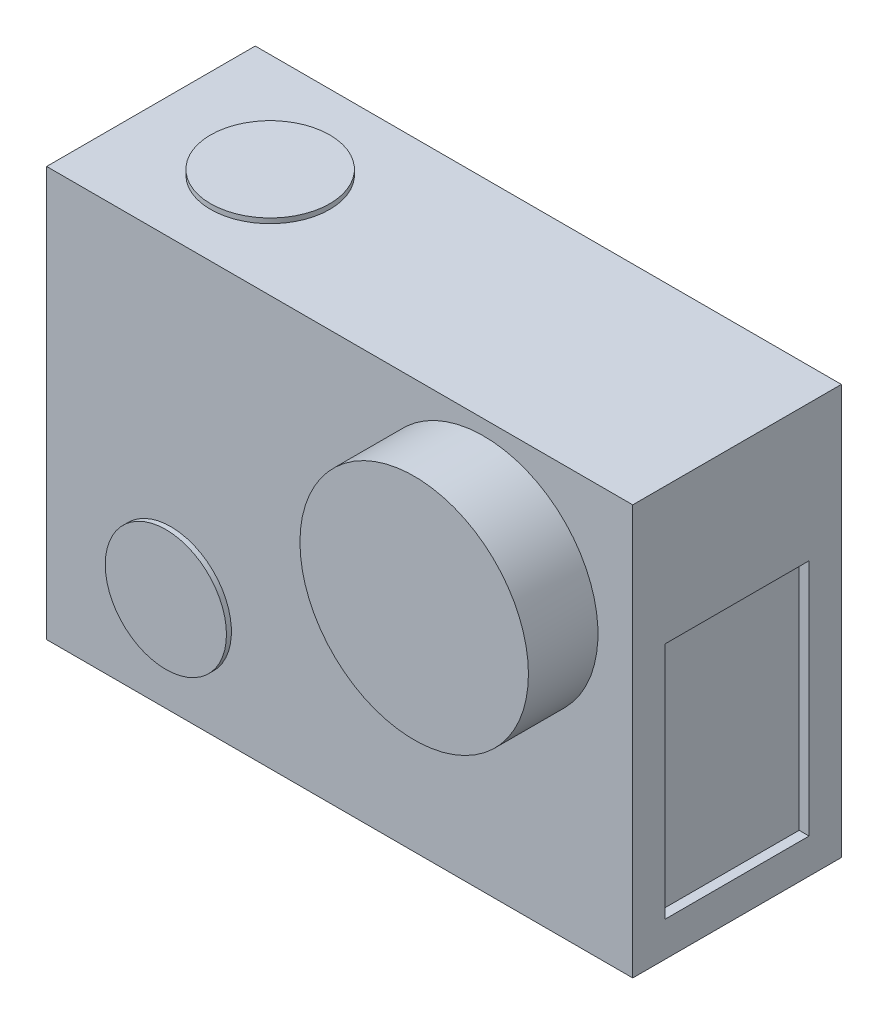
from build123d import *

# Parameters (mm, degrees)
SKETCH1_W           = 59
SKETCH1_H           = 41.25
BOSS_EXTRUDE1_DEPTH = 21
SKETCH2_R           = 11.5
BOSS_EXTRUDE2_DEPTH = 7
SKETCH3_R           = 6.1
BOSS_EXTRUDE3_DEPTH = 0.5
SKETCH4_W           = 14.5
SKETCH4_H           = 24
CUT_EXTRUDE1_DEPTH  = 1
SKETCH5_W           = 47
SKETCH5_H           = 36.5
CUT_EXTRUDE2_DEPTH  = 0.2
SKETCH6_R           = 6
BOSS_EXTRUDE4_DEPTH = 0.5


with BuildPart() as part:
    # Sketch1 → Boss-Extrude1 (new body)
    with BuildSketch(Plane.XY):
        Rectangle(SKETCH1_W, SKETCH1_H)
    extrude(amount=BOSS_EXTRUDE1_DEPTH)

    # Sketch2 → Boss-Extrude2 (add)
    with BuildSketch(Plane.XY.offset(21)):
        with Locations(Location((14.5, 7.625, 0), (0, 0, 180))):
            Circle(SKETCH2_R)
    extrude(amount=BOSS_EXTRUDE2_DEPTH)

    # Sketch3 → Boss-Extrude3 (add)
    with BuildSketch(Plane.XY.offset(21)):
        with Locations(Location((-17, -10.625, 0), (0, 0, 180))):
            Circle(SKETCH3_R)
    extrude(amount=BOSS_EXTRUDE3_DEPTH)

    # Sketch4 → Cut-Extrude1 (cut)
    with BuildSketch(Plane(origin=(29.5, 0, 0), x_dir=(0, 0, -1), z_dir=(1, 0, 0))):
        with Locations((-10.5, -5.125)):
            Rectangle(SKETCH4_W, SKETCH4_H)
    extrude(amount=-CUT_EXTRUDE1_DEPTH, mode=Mode.SUBTRACT)

    # Sketch5 → Cut-Extrude2 (cut)
    with BuildSketch(Plane(origin=(0, 0, 0), x_dir=(-1, 0, 0), z_dir=(0, 0, -1))):
        Rectangle(SKETCH5_W, SKETCH5_H)
    extrude(amount=-CUT_EXTRUDE2_DEPTH, mode=Mode.SUBTRACT)

    # Sketch6 → Boss-Extrude4 (add)
    with BuildSketch(Plane(origin=(0, 20.625, 0), x_dir=(1, 0, 0), z_dir=(0, 1, 0))):
        with Locations((-17.5, -10.5)):
            Circle(SKETCH6_R)
    extrude(amount=BOSS_EXTRUDE4_DEPTH)


solid = part.part
